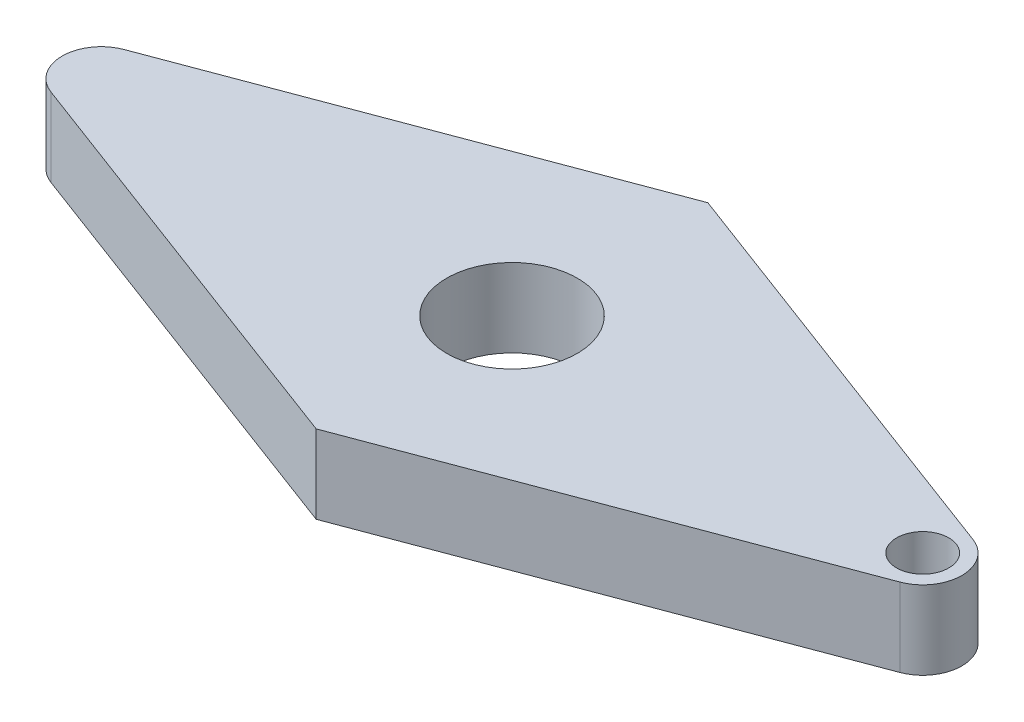
from build123d import *

# Parameters (mm, degrees)
SKETCH_1_R          = 2.5
EXTRUDE_1_DEPTH     = 3
SKETCH_3_R          = 1
CUT_EXTRUDE_1_DEPTH = 20.02771451


with BuildPart() as part:
    # 草圖1 → 填料-伸長1 (new body)
    with BuildSketch(Plane(origin=(0, 0, 0), x_dir=(1, 0, 0), z_dir=(0, 1, 0))):
        with BuildLine():
            Line((-16.25468329, 1.404493766), (0, 7.5))
            Line((0, 7.5), (16.25468329, 1.404493766))
            ThreePointArc((16.25468329, 1.404493766), (17.227998127, 0), (16.25468329, -1.404493766))
            Line((16.25468329, -1.404493766), (0, -7.5))
            Line((0, -7.5), (-16.25468329, -1.404493766))
            ThreePointArc((-16.25468329, -1.404493766), (-17.227998127, 0), (-16.25468329, 1.404493766))
        make_face()
        with Locations(Location((0, 0, 0), (0, 0, 270))):
            Circle(SKETCH_1_R, mode=Mode.SUBTRACT)
    extrude(amount=EXTRUDE_1_DEPTH)

    # 草圖3 → 除料-伸長1 (cut, through all)
    with BuildSketch(Plane(origin=(0, 3, 0), x_dir=(1, 0, 0), z_dir=(0, 1, 0))):
        with Locations(Location((15.727998127, 0, 0), (0, 0, 270))):
            Circle(SKETCH_3_R)
    extrude(amount=-CUT_EXTRUDE_1_DEPTH, mode=Mode.SUBTRACT)


solid = part.part
